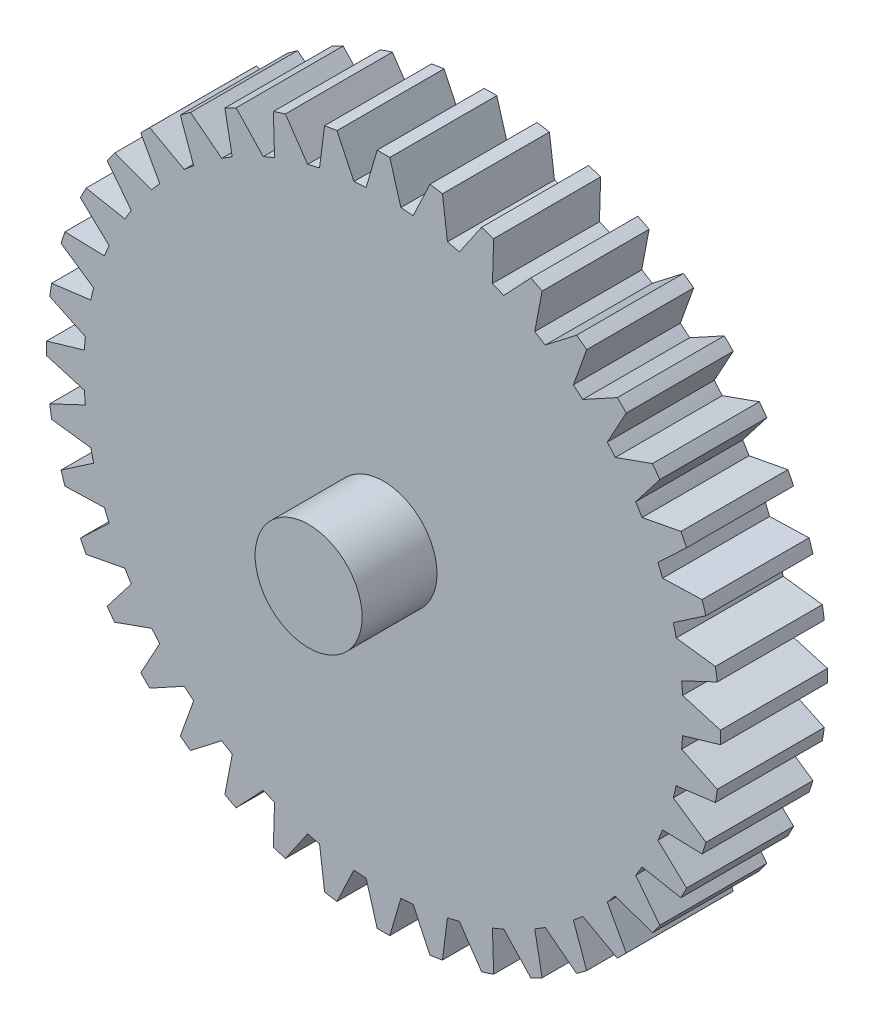
from build123d import *

# Parameters (mm, degrees)
BOSS_EXTRUDE2_DEPTH = 5
BOSS_EXTRUDE3_START = 5
BOSS_EXTRUDE3_DEPTH = 7
CUT_EXTRUDE3_START  = -5
CUT_EXTRUDE3_DEPTH  = 3


with BuildPart() as part:
    # Sketch1 → Boss-Extrude2 (new, symmetric)
    with BuildSketch(Plane.XY):
        with BuildLine():
            Line((4.344085089, 31.199021214), (2.767788732, 27.862866786))
            ThreePointArc((2.767788732, 27.862866786), (2.19685468, 27.913685345), (1.625, 27.95280621))
            Line((1.625, 27.95280621), (0.59, 31.494474118))
            Line((0.59, 31.494474118), (-0.59, 31.494474118))
            Line((-0.59, 31.494474118), (-1.625, 27.95280621))
            ThreePointArc((-1.625, 27.95280621), (-2.19685468, 27.913685345), (-2.767788732, 27.862866786))
            Line((-2.767788732, 27.862866786), (-4.344085089, 31.199021214))
            ThreePointArc((-4.344085089, 31.199021214), (-4.927685649, 31.112182729), (-5.509557331, 31.014428546))
            Line((-5.509557331, 31.014428546), (-5.977775839, 27.354454775))
            ThreePointArc((-5.977775839, 27.354454775), (-6.536470188, 27.226357771), (-7.09242532, 27.08685111))
            Line((-7.09242532, 27.08685111), (-9.171204387, 30.135344864))
            ThreePointArc((-9.171204387, 30.135344864), (-9.734035323, 29.958280263), (-10.293451076, 29.770704811))
            Line((-10.293451076, 29.770704811), (-10.183358998, 26.082545879))
            ThreePointArc((-10.183358998, 26.082545879), (-10.715136106, 25.86862691), (-11.242422858, 25.643867264))
            Line((-11.242422858, 25.643867264), (-13.772498195, 28.32963631))
            ThreePointArc((-13.772498195, 28.32963631), (-14.300700742, 28.066705512), (-14.823885893, 27.793927521))
            Line((-14.823885893, 27.793927521), (-14.138194062, 24.16839814))
            ThreePointArc((-14.138194062, 24.16839814), (-14.629959812, 23.873924602), (-15.115594634, 23.569446299))
            Line((-15.115594634, 23.569446299), (-18.034667389, 25.82635809))
            ThreePointArc((-18.034667389, 25.82635809), (-18.515235447, 25.484035323), (-18.989307442, 25.132771492))
            Line((-18.989307442, 25.132771492), (-17.744899866, 21.659144229))
            ThreePointArc((-17.744899866, 21.659144229), (-18.184545353, 21.291367037), (-18.616570305, 20.914667344))
            Line((-18.616570305, 20.914667344), (-21.852763218, 22.68714922))
            ThreePointArc((-21.852763218, 22.68714922), (-22.273863607, 22.273863607), (-22.68714922, 21.852763218))
            Line((-22.68714922, 21.852763218), (-20.914667344, 18.616570305))
            ThreePointArc((-20.914667344, 18.616570305), (-21.291367037, 18.184545353), (-21.659144229, 17.744899866))
            Line((-21.659144229, 17.744899866), (-25.132771492, 18.989307442))
            ThreePointArc((-25.132771492, 18.989307442), (-25.484035323, 18.515235447), (-25.82635809, 18.034667389))
            Line((-25.82635809, 18.034667389), (-23.569446299, 15.115594634))
            ThreePointArc((-23.569446299, 15.115594634), (-23.873924602, 14.629959812), (-24.16839814, 14.138194062))
            Line((-24.16839814, 14.138194062), (-27.793927521, 14.823885893))
            ThreePointArc((-27.793927521, 14.823885893), (-28.066705512, 14.300700742), (-28.32963631, 13.772498195))
            Line((-28.32963631, 13.772498195), (-25.643867264, 11.242422858))
            ThreePointArc((-25.643867264, 11.242422858), (-25.86862691, 10.715136106), (-26.082545879, 10.183358998))
            Line((-26.082545879, 10.183358998), (-29.770704811, 10.293451076))
            ThreePointArc((-29.770704811, 10.293451076), (-29.958280263, 9.734035323), (-30.135344864, 9.171204387))
            Line((-30.135344864, 9.171204387), (-27.08685111, 7.09242532))
            ThreePointArc((-27.08685111, 7.09242532), (-27.226357771, 6.536470188), (-27.354454775, 5.977775839))
            Line((-27.354454775, 5.977775839), (-31.014428546, 5.509557331))
            ThreePointArc((-31.014428546, 5.509557331), (-31.112182729, 4.927685649), (-31.199021214, 4.344085089))
            Line((-31.199021214, 4.344085089), (-27.862866786, 2.767788732))
            ThreePointArc((-27.862866786, 2.767788732), (-27.913685345, 2.19685468), (-27.95280621, 1.625))
            Line((-27.95280621, 1.625), (-31.494474118, 0.59))
            ThreePointArc((-31.494474118, 0.59), (-31.5, 0), (-31.494474118, -0.59))
            Line((-31.494474118, -0.59), (-27.95280621, -1.625))
            ThreePointArc((-27.95280621, -1.625), (-27.913685345, -2.19685468), (-27.862866786, -2.767788732))
            Line((-27.862866786, -2.767788732), (-31.199021214, -4.344085089))
            ThreePointArc((-31.199021214, -4.344085089), (-31.112182729, -4.927685649), (-31.014428546, -5.509557331))
            Line((-31.014428546, -5.509557331), (-27.354454775, -5.977775839))
            ThreePointArc((-27.354454775, -5.977775839), (-27.226357771, -6.536470188), (-27.08685111, -7.09242532))
            Line((-27.08685111, -7.09242532), (-30.135344864, -9.171204387))
            ThreePointArc((-30.135344864, -9.171204387), (-29.958280263, -9.734035323), (-29.770704811, -10.293451076))
            Line((-29.770704811, -10.293451076), (-26.082545879, -10.183358998))
            ThreePointArc((-26.082545879, -10.183358998), (-25.86862691, -10.715136106), (-25.643867264, -11.242422858))
            Line((-25.643867264, -11.242422858), (-28.32963631, -13.772498195))
            ThreePointArc((-28.32963631, -13.772498195), (-28.066705512, -14.300700742), (-27.793927521, -14.823885893))
            Line((-27.793927521, -14.823885893), (-24.16839814, -14.138194062))
            ThreePointArc((-24.16839814, -14.138194062), (-23.873924602, -14.629959812), (-23.569446299, -15.115594634))
            Line((-23.569446299, -15.115594634), (-25.82635809, -18.034667389))
            ThreePointArc((-25.82635809, -18.034667389), (-25.484035323, -18.515235447), (-25.132771492, -18.989307442))
            Line((-25.132771492, -18.989307442), (-21.659144229, -17.744899866))
            ThreePointArc((-21.659144229, -17.744899866), (-21.291367037, -18.184545353), (-20.914667344, -18.616570305))
            Line((-20.914667344, -18.616570305), (-22.68714922, -21.852763218))
            ThreePointArc((-22.68714922, -21.852763218), (-22.273863607, -22.273863607), (-21.852763218, -22.68714922))
            Line((-21.852763218, -22.68714922), (-18.616570305, -20.914667344))
            ThreePointArc((-18.616570305, -20.914667344), (-18.184545353, -21.291367037), (-17.744899866, -21.659144229))
            Line((-17.744899866, -21.659144229), (-18.989307442, -25.132771492))
            ThreePointArc((-18.989307442, -25.132771492), (-18.515235447, -25.484035323), (-18.034667389, -25.82635809))
            Line((-18.034667389, -25.82635809), (-15.115594634, -23.569446299))
            ThreePointArc((-15.115594634, -23.569446299), (-14.629959812, -23.873924602), (-14.138194062, -24.16839814))
            Line((-14.138194062, -24.16839814), (-14.823885893, -27.793927521))
            ThreePointArc((-14.823885893, -27.793927521), (-14.300700742, -28.066705512), (-13.772498195, -28.32963631))
            Line((-13.772498195, -28.32963631), (-11.242422858, -25.643867264))
            ThreePointArc((-11.242422858, -25.643867264), (-10.715136106, -25.86862691), (-10.183358998, -26.082545879))
            Line((-10.183358998, -26.082545879), (-10.293451076, -29.770704811))
            ThreePointArc((-10.293451076, -29.770704811), (-9.734035323, -29.958280263), (-9.171204387, -30.135344864))
            Line((-9.171204387, -30.135344864), (-7.09242532, -27.08685111))
            ThreePointArc((-7.09242532, -27.08685111), (-6.536470188, -27.226357771), (-5.977775839, -27.354454775))
            Line((-5.977775839, -27.354454775), (-5.509557331, -31.014428546))
            ThreePointArc((-5.509557331, -31.014428546), (-4.927685649, -31.112182729), (-4.344085089, -31.199021214))
            Line((-4.344085089, -31.199021214), (-2.767788732, -27.862866786))
            ThreePointArc((-2.767788732, -27.862866786), (-2.19685468, -27.913685345), (-1.625, -27.95280621))
            Line((-1.625, -27.95280621), (-0.59, -31.494474118))
            ThreePointArc((-0.59, -31.494474118), (0, -31.5), (0.59, -31.494474118))
            Line((0.59, -31.494474118), (1.625, -27.95280621))
            ThreePointArc((1.625, -27.95280621), (2.19685468, -27.913685345), (2.767788732, -27.862866786))
            Line((2.767788732, -27.862866786), (4.344085089, -31.199021214))
            ThreePointArc((4.344085089, -31.199021214), (4.927685649, -31.112182729), (5.509557331, -31.014428546))
            Line((5.509557331, -31.014428546), (5.977775839, -27.354454775))
            ThreePointArc((5.977775839, -27.354454775), (6.536470188, -27.226357771), (7.09242532, -27.08685111))
            Line((7.09242532, -27.08685111), (9.171204387, -30.135344864))
            ThreePointArc((9.171204387, -30.135344864), (9.734035323, -29.958280263), (10.293451076, -29.770704811))
            Line((10.293451076, -29.770704811), (10.183358998, -26.082545879))
            ThreePointArc((10.183358998, -26.082545879), (10.715136106, -25.86862691), (11.242422858, -25.643867264))
            Line((11.242422858, -25.643867264), (13.772498195, -28.32963631))
            ThreePointArc((13.772498195, -28.32963631), (14.300700742, -28.066705512), (14.823885893, -27.793927521))
            Line((14.823885893, -27.793927521), (14.138194062, -24.16839814))
            ThreePointArc((14.138194062, -24.16839814), (14.629959812, -23.873924602), (15.115594634, -23.569446299))
            Line((15.115594634, -23.569446299), (18.034667389, -25.82635809))
            ThreePointArc((18.034667389, -25.82635809), (18.515235447, -25.484035323), (18.989307442, -25.132771492))
            Line((18.989307442, -25.132771492), (17.744899866, -21.659144229))
            ThreePointArc((17.744899866, -21.659144229), (18.184545353, -21.291367037), (18.616570305, -20.914667344))
            Line((18.616570305, -20.914667344), (21.852763218, -22.68714922))
            ThreePointArc((21.852763218, -22.68714922), (22.273863607, -22.273863607), (22.68714922, -21.852763218))
            Line((22.68714922, -21.852763218), (20.914667344, -18.616570305))
            ThreePointArc((20.914667344, -18.616570305), (21.291367037, -18.184545353), (21.659144229, -17.744899866))
            Line((21.659144229, -17.744899866), (25.132771492, -18.989307442))
            ThreePointArc((25.132771492, -18.989307442), (25.484035323, -18.515235447), (25.82635809, -18.034667389))
            Line((25.82635809, -18.034667389), (23.569446299, -15.115594634))
            ThreePointArc((23.569446299, -15.115594634), (23.873924602, -14.629959812), (24.16839814, -14.138194062))
            Line((24.16839814, -14.138194062), (27.793927521, -14.823885893))
            ThreePointArc((27.793927521, -14.823885893), (28.066705512, -14.300700742), (28.32963631, -13.772498195))
            Line((28.32963631, -13.772498195), (25.643867264, -11.242422858))
            ThreePointArc((25.643867264, -11.242422858), (25.86862691, -10.715136106), (26.082545879, -10.183358998))
            Line((26.082545879, -10.183358998), (29.770704811, -10.293451076))
            ThreePointArc((29.770704811, -10.293451076), (29.958280263, -9.734035323), (30.135344864, -9.171204387))
            Line((30.135344864, -9.171204387), (27.08685111, -7.09242532))
            ThreePointArc((27.08685111, -7.09242532), (27.226357771, -6.536470188), (27.354454775, -5.977775839))
            Line((27.354454775, -5.977775839), (31.014428546, -5.509557331))
            ThreePointArc((31.014428546, -5.509557331), (31.112182729, -4.927685649), (31.199021214, -4.344085089))
            Line((31.199021214, -4.344085089), (27.862866786, -2.767788732))
            ThreePointArc((27.862866786, -2.767788732), (27.913685345, -2.19685468), (27.95280621, -1.625))
            Line((27.95280621, -1.625), (31.494474118, -0.59))
            ThreePointArc((31.494474118, -0.59), (31.5, 0), (31.494474118, 0.59))
            Line((31.494474118, 0.59), (27.95280621, 1.625))
            ThreePointArc((27.95280621, 1.625), (27.913685345, 2.19685468), (27.862866786, 2.767788732))
            Line((27.862866786, 2.767788732), (31.199021214, 4.344085089))
            ThreePointArc((31.199021214, 4.344085089), (31.112182729, 4.927685649), (31.014428546, 5.509557331))
            Line((31.014428546, 5.509557331), (27.354454775, 5.977775839))
            ThreePointArc((27.354454775, 5.977775839), (27.226357771, 6.536470188), (27.08685111, 7.09242532))
            Line((27.08685111, 7.09242532), (30.135344864, 9.171204387))
            ThreePointArc((30.135344864, 9.171204387), (29.958280263, 9.734035323), (29.770704811, 10.293451076))
            Line((29.770704811, 10.293451076), (26.082545879, 10.183358998))
            ThreePointArc((26.082545879, 10.183358998), (25.86862691, 10.715136106), (25.643867264, 11.242422858))
            Line((25.643867264, 11.242422858), (28.32963631, 13.772498195))
            ThreePointArc((28.32963631, 13.772498195), (28.066705512, 14.300700742), (27.793927521, 14.823885893))
            Line((27.793927521, 14.823885893), (24.16839814, 14.138194062))
            ThreePointArc((24.16839814, 14.138194062), (23.873924602, 14.629959812), (23.569446299, 15.115594634))
            Line((23.569446299, 15.115594634), (25.82635809, 18.034667389))
            ThreePointArc((25.82635809, 18.034667389), (25.484035323, 18.515235447), (25.132771492, 18.989307442))
            Line((25.132771492, 18.989307442), (21.659144229, 17.744899866))
            ThreePointArc((21.659144229, 17.744899866), (21.291367037, 18.184545353), (20.914667344, 18.616570305))
            Line((20.914667344, 18.616570305), (22.68714922, 21.852763218))
            ThreePointArc((22.68714922, 21.852763218), (22.273863607, 22.273863607), (21.852763218, 22.68714922))
            Line((21.852763218, 22.68714922), (18.616570305, 20.914667344))
            ThreePointArc((18.616570305, 20.914667344), (18.184545353, 21.291367037), (17.744899866, 21.659144229))
            Line((17.744899866, 21.659144229), (18.989307442, 25.132771492))
            ThreePointArc((18.989307442, 25.132771492), (18.515235447, 25.484035323), (18.034667389, 25.82635809))
            Line((18.034667389, 25.82635809), (15.115594634, 23.569446299))
            ThreePointArc((15.115594634, 23.569446299), (14.629959812, 23.873924602), (14.138194062, 24.16839814))
            Line((14.138194062, 24.16839814), (14.823885893, 27.793927521))
            ThreePointArc((14.823885893, 27.793927521), (14.300700742, 28.066705512), (13.772498195, 28.32963631))
            Line((13.772498195, 28.32963631), (11.242422858, 25.643867264))
            ThreePointArc((11.242422858, 25.643867264), (10.715136106, 25.86862691), (10.183358998, 26.082545879))
            Line((10.183358998, 26.082545879), (10.293451076, 29.770704811))
            ThreePointArc((10.293451076, 29.770704811), (9.734035323, 29.958280263), (9.171204387, 30.135344864))
            Line((9.171204387, 30.135344864), (7.09242532, 27.08685111))
            ThreePointArc((7.09242532, 27.08685111), (6.536470188, 27.226357771), (5.977775839, 27.354454775))
            Line((5.977775839, 27.354454775), (5.509557331, 31.014428546))
            ThreePointArc((5.509557331, 31.014428546), (4.927685649, 31.112182729), (4.344085089, 31.199021214))
        make_face()
    extrude(amount=BOSS_EXTRUDE2_DEPTH, both=True)

    # Sketch1<6> → Boss-Extrude3 (add)
    with BuildSketch(Plane.XY.offset(BOSS_EXTRUDE3_START)):
        with BuildLine():
            Line((-3.417235725, -3.65), (3.417235725, -3.65))
            ThreePointArc((3.417235725, -3.65), (4.587274715, -1.989198504), (5, 0))
            ThreePointArc((5, 0), (4.587274715, 1.989198504), (3.417235725, 3.65))
            Line((3.417235725, 3.65), (-3.417235725, 3.65))
            ThreePointArc((-3.417235725, 3.65), (-5, 0), (-3.417235725, -3.65))
        make_face()
        with BuildLine():
            Line((-3.417235725, 3.65), (3.417235725, 3.65))
            ThreePointArc((3.417235725, 3.65), (0, 5), (-3.417235725, 3.65))
        make_face()
        with BuildLine():
            ThreePointArc((-3.417235725, -3.65), (0, -5), (3.417235725, -3.65))
            Line((3.417235725, -3.65), (-3.417235725, -3.65))
        make_face()
    extrude(amount=BOSS_EXTRUDE3_DEPTH)

    # Sketch1<8> → Cut-Extrude3 (cut)
    with BuildSketch(Plane.XY.offset(CUT_EXTRUDE3_START)):
        with BuildLine():
            Line((3.417235725, -3.65), (16.5, -3.65))
            Line((16.5, -3.65), (16.5, 3.65))
            Line((16.5, 3.65), (3.417235725, 3.65))
            ThreePointArc((3.417235725, 3.65), (4.587274715, 1.989198504), (5, 0))
            ThreePointArc((5, 0), (4.587274715, -1.989198504), (3.417235725, -3.65))
        make_face()
        with BuildLine():
            Line((-16.5, -3.65), (-3.417235725, -3.65))
            ThreePointArc((-3.417235725, -3.65), (-5, 0), (-3.417235725, 3.65))
            Line((-3.417235725, 3.65), (-16.5, 3.65))
            Line((-16.5, 3.65), (-16.5, -3.65))
        make_face()
        with BuildLine():
            Line((-3.417235725, -3.65), (3.417235725, -3.65))
            ThreePointArc((3.417235725, -3.65), (4.587274715, -1.989198504), (5, 0))
            ThreePointArc((5, 0), (4.587274715, 1.989198504), (3.417235725, 3.65))
            Line((3.417235725, 3.65), (-3.417235725, 3.65))
            ThreePointArc((-3.417235725, 3.65), (-5, 0), (-3.417235725, -3.65))
        make_face()
    extrude(amount=CUT_EXTRUDE3_DEPTH, mode=Mode.SUBTRACT)


solid = part.part
